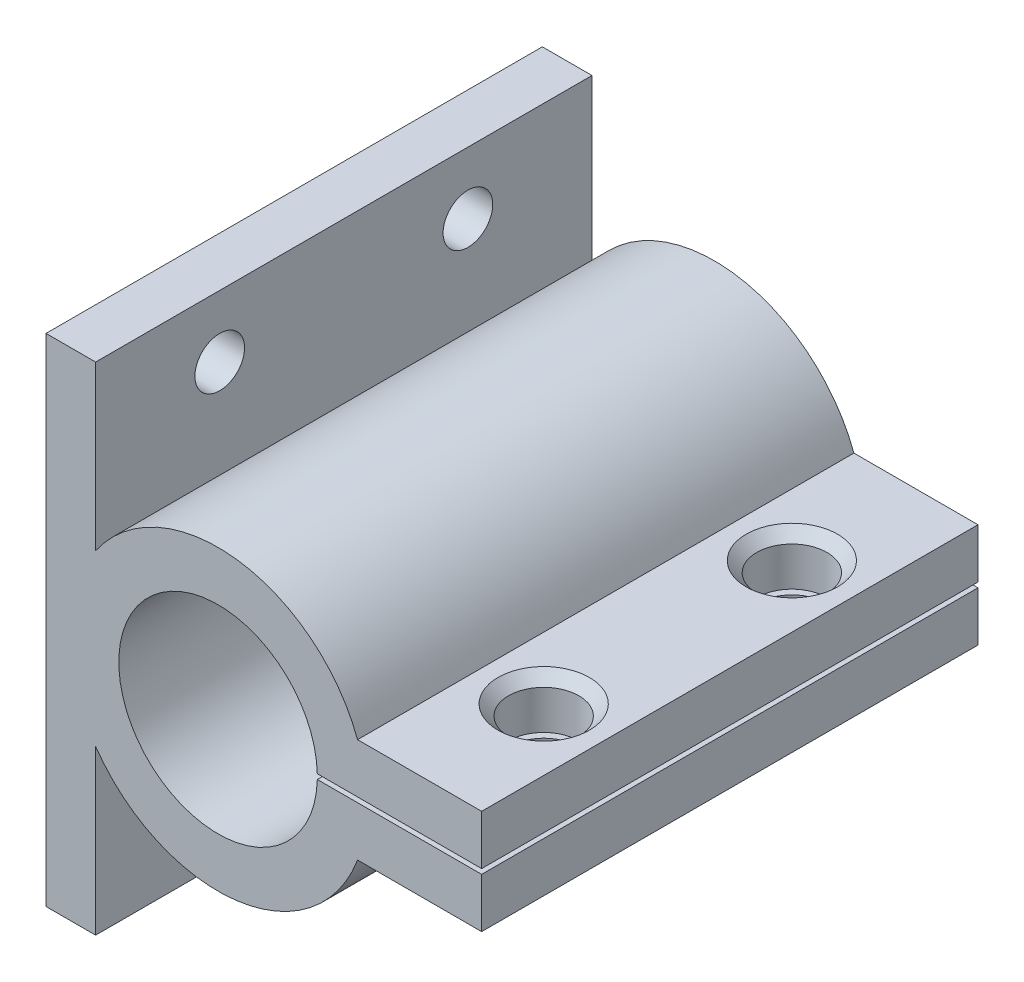
from build123d import *

# Parameters (mm, degrees)
EXTRUDE_1_DEPTH               = 60
SKETCH_2_R                    = 3
CUT_EXTRUDE_1_DEPTH           = 83.791703555
HOLE_WIZARD_M10_1_D           = 8.5
HOLE_WIZARD_M10_1_DEPTH       = 27.5
HOLE_WIZARD_M10_1_CSINK_D     = 11.05
HOLE_WIZARD_M10_1_CSINK_ANGLE = 90
HOLE_WIZARD_M10_1_TIP         = 2.553657631


with BuildPart() as part:
    # 草图1 → 凸台-拉伸1 (new body)
    with BuildSketch(Plane.XY):
        with BuildLine():
            Line((-34.31692533, -27.181035016), (-34.31692533, 32.818964984))
            Line((-34.31692533, 32.818964984), (-28.31692533, 32.818964984))
            Line((-28.31692533, 32.818964984), (-28.31692533, 13.062622536))
            ThreePointArc((-28.31692533, 13.062622536), (-11.291229121, 20.680947179), (3.345497613, 9.118964984))
            Line((3.345497613, 9.118964984), (18.345497613, 9.118964984))
            Line((18.345497613, 9.118964984), (18.345497613, 3.118964984))
            Line((18.345497613, 3.118964984), (-1.519747569, 3.118964984))
            ThreePointArc((-1.519747569, 3.118964984), (-25.515996982, 2.818964984), (-1.519747569, 2.518964984))
            Line((-1.519747569, 2.518964984), (18.345497613, 2.518964984))
            Line((18.345497613, 2.518964984), (18.345497613, -3.481035016))
            Line((18.345497613, -3.481035016), (3.345497613, -3.481035016))
            ThreePointArc((3.345497613, -3.481035016), (-11.291229121, -15.043017212), (-28.31692533, -7.424692569))
            Line((-28.31692533, -7.424692569), (-28.31692533, -27.181035016))
            Line((-28.31692533, -27.181035016), (-34.31692533, -27.181035016))
        make_face()
    extrude(amount=EXTRUDE_1_DEPTH)

    # 草图2 → 切除-拉伸1 (cut, through all)
    with BuildSketch(Plane(origin=(-28.31692533, 0, 0), x_dir=(0, 0, -1), z_dir=(1, 0, 0))):
        with Locations((-45, 25.318964984)):
            Circle(SKETCH_2_R)
        with Locations((-15, 25.318964984)):
            Circle(SKETCH_2_R)
    cut_extrude_1 = extrude(amount=-CUT_EXTRUDE_1_DEPTH, mode=Mode.SUBTRACT)

    # 镜向3: 切除-拉伸1 across plane
    add(cut_extrude_1.mirror(Plane.ZX.offset(2.818964984)), mode=Mode.SUBTRACT)

    # M10 螺纹孔1
    with Locations(Plane(origin=(10.845497613, 9.118964984, 15), x_dir=(1, 0, 0), z_dir=(0, 1, 0))):
        with Locations((0, 0), (0, -30)):
            CounterSinkHole(HOLE_WIZARD_M10_1_D / 2, HOLE_WIZARD_M10_1_CSINK_D / 2, depth=HOLE_WIZARD_M10_1_DEPTH, counter_sink_angle=HOLE_WIZARD_M10_1_CSINK_ANGLE)
            with Locations((0, 0, -(HOLE_WIZARD_M10_1_DEPTH + HOLE_WIZARD_M10_1_TIP / 2))):  # 118° drill point
                Cone(0, HOLE_WIZARD_M10_1_D / 2, HOLE_WIZARD_M10_1_TIP, mode=Mode.SUBTRACT)


solid = part.part
